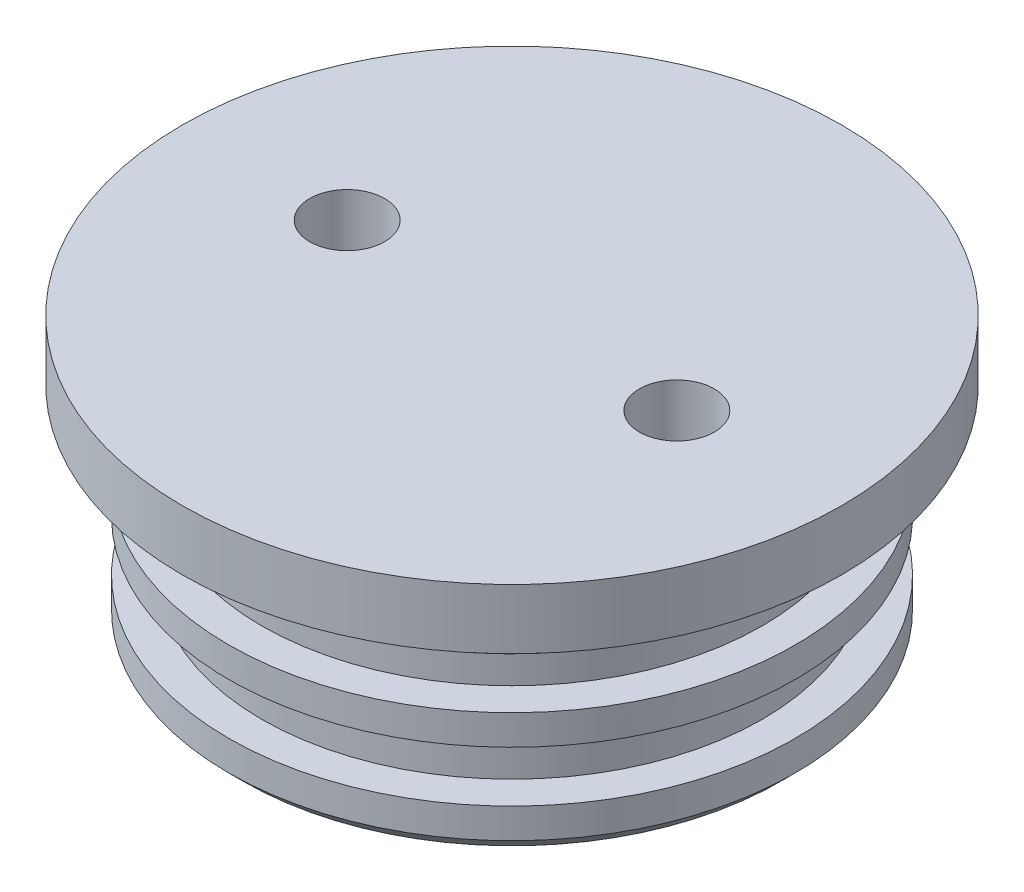
from build123d import *

# Parameters (mm, degrees)
SKETCH_1_R          = 11
EXTRUDE_1_DEPTH     = 9
SKETCH_2_R          = 0.5
CUT_EXTRUDE_1_DEPTH = 18.972200756
SKETCH_3_R          = 16.549134696
SKETCH_3_R_2        = 9.45
CUT_EXTRUDE_2_DEPTH = 7
SKETCH_4_W          = 2.2
SKETCH_4_H          = 1.7
SKETCH_5_R          = 3
CUT_EXTRUDE_3_DEPTH = 7
SKETCH_7_R          = 1.25
CUT_EXTRUDE_5_DEPTH = 2.5
CUT_EXTRUDE_START   = -1.5
SKETCH_8_R          = 1.25
CUT_EXTRUDE_6_DEPTH = 1.5
SKETCH_9_R          = 4
CUT_EXTRUDE_7_DEPTH = 2
CHAMFER_1_SIZE      = 0.5


with BuildPart() as part:
    # 草图1 → 凸台-拉伸1 (new body)
    with BuildSketch(Plane(origin=(0, 0, 0), x_dir=(1, 0, 0), z_dir=(0, 1, 0))):
        with Locations(Location((0, 0, 0), (0, 0, 270))):
            Circle(SKETCH_1_R)
    extrude(amount=EXTRUDE_1_DEPTH)

    # 草图2 → 切除-拉伸1 (cut, through all)
    with BuildSketch(Plane(origin=(0, 9, 0), x_dir=(1, 0, 0), z_dir=(0, 1, 0))):
        with Locations(Location((-5.5, 0, 0), (0, 0, 270))):
            Circle(SKETCH_2_R)
        with Locations(Location((5.5, 0, 0), (0, 0, 270))):
            Circle(SKETCH_2_R)
    extrude(amount=-CUT_EXTRUDE_1_DEPTH, mode=Mode.SUBTRACT)

    # 草图3 → 切除-拉伸2 (cut)
    with BuildSketch(Plane.XZ):
        Circle(SKETCH_3_R)
        with Locations(Location((0, 0, 0), (0, 0, 270))):
            Circle(SKETCH_3_R_2, mode=Mode.SUBTRACT)
    extrude(amount=-CUT_EXTRUDE_2_DEPTH, mode=Mode.SUBTRACT)

    # 草图4 → 切除-旋转1 (revolve, cut)
    with BuildSketch(Plane.XY, mode=Mode.PRIVATE) as cut_revolve_1_sk:
        with Locations((-9.45, 5.05)):
            Rectangle(SKETCH_4_W, SKETCH_4_H)
        with Locations((-9.45, 2.35)):
            Rectangle(SKETCH_4_W, SKETCH_4_H)
    revolve(cut_revolve_1_sk.sketch.rotate(Axis((0, 0, 0), (0, 1, 0)), 270), axis=Axis((0, 0, 0), (0, 1, 0)), mode=Mode.SUBTRACT)

    # 草图5 → 切除-拉伸3 (cut)
    with BuildSketch(Plane.XZ):
        with Locations(Location((0, 0, 0), (0, 0, 270))):
            Circle(SKETCH_5_R)
    extrude(amount=-CUT_EXTRUDE_3_DEPTH, mode=Mode.SUBTRACT)

    # 草图7 → 切除-拉伸5 (cut)
    with BuildSketch(Plane(origin=(0, 9, 0), x_dir=(1, 0, 0), z_dir=(0, 1, 0))):
        with Locations(Location((-5.5, 0, 0), (0, 0, 270))):
            Circle(SKETCH_7_R)
        with Locations(Location((5.5, 0, 0), (0, 0, 270))):
            Circle(SKETCH_7_R)
    extrude(amount=-CUT_EXTRUDE_5_DEPTH, mode=Mode.SUBTRACT)

    # 草图8 → 切除-拉伸6 (cut)
    with BuildSketch(Plane.XZ.offset(CUT_EXTRUDE_START)):
        with Locations(Location((-5.5, 0, 0), (0, 0, 90))):
            Circle(SKETCH_8_R)
        with Locations(Location((5.5, 0, 0), (0, 0, 90))):
            Circle(SKETCH_8_R)
    extrude(amount=CUT_EXTRUDE_6_DEPTH, mode=Mode.SUBTRACT)

    # 草图9 → 切除-拉伸7 (cut)
    with BuildSketch(Plane.XZ):
        with Locations(Location((0, 0, 0), (0, 0, 270))):
            Circle(SKETCH_9_R)
    extrude(amount=-CUT_EXTRUDE_7_DEPTH, mode=Mode.SUBTRACT)

    # 倒角1
    chamfer_1_edges = [part.edges().sort_by_distance(p)[0] for p in [
        (0, 0, 9.45),
    ]]
    chamfer(chamfer_1_edges, length=CHAMFER_1_SIZE)


solid = part.part
